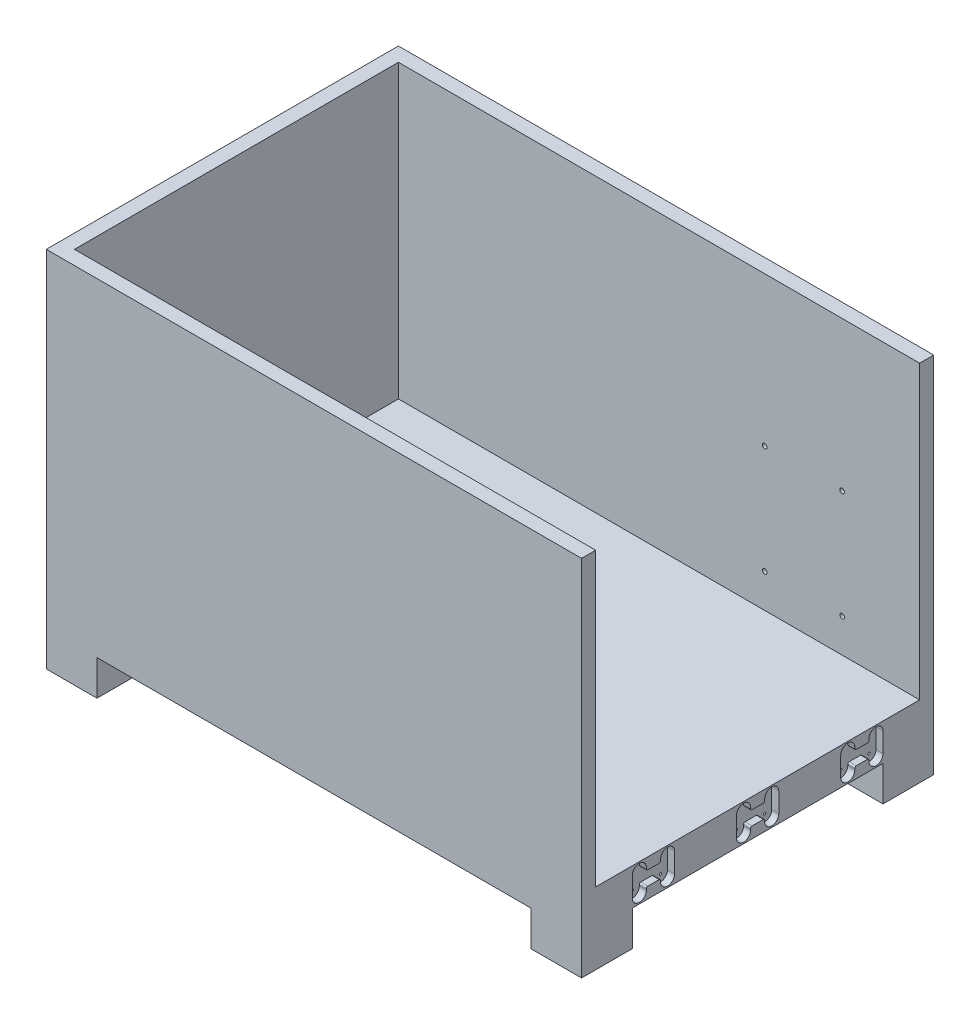
from build123d import *

# Parameters (mm, degrees)
SKETCH_1_W             = 380
SKETCH_1_H             = 250
EXTRUDE_1_DEPTH        = 233
SKETCH_4_W             = 36
SKETCH_4_H             = 36
EXTRUDE_2_DEPTH        = 25
HOLE_WIZARD_M6_1_D     = 5
HOLE_WIZARD_M6_1_DEPTH = 15
HOLE_WIZARD_M6_1_TIP   = 1.502151548
SKETCH_2_W             = 360
SKETCH_2_H             = 230
CUT_EXTRUDE_1_DEPTH    = 207
HOLE_WIZARD_M4_1_D     = 3.3
HOLE_WIZARD_M4_1_DEPTH = 10
SKETCH_7_W             = 10
SKETCH_7_H             = 230
CUT_EXTRUDE_3_DEPTH    = 207
HOLE_WIZARD_M2_1_D     = 1.6
HOLE_WIZARD_M2_1_DEPTH = 15
HOLE_WIZARD_M2_1_TIP   = 0.480688495
CUT_EXTRUDE_START      = -5
SKETCH_22_R            = 0.8
CUT_EXTRUDE_6_DEPTH    = 5


with BuildPart() as part:
    # 草图1 → 凸台-拉伸1 (new body)
    with BuildSketch(Plane(origin=(0, 0, 0), x_dir=(1, 0, 0), z_dir=(0, 1, 0))):
        with Locations((19.448818898, -32.543307087)):
            Rectangle(SKETCH_1_W, SKETCH_1_H)
    extrude(amount=EXTRUDE_1_DEPTH)

    # 草图4 → 凸台-拉伸2 (add)
    with BuildSketch(Plane.XZ):
        with Locations((-152.551181102, 139.543307087)):
            Rectangle(SKETCH_4_W, SKETCH_4_H)
        with Locations((191.448818898, 139.543307087)):
            Rectangle(SKETCH_4_W, SKETCH_4_H)
        with Locations((191.448818898, -74.456692913)):
            Rectangle(SKETCH_4_W, SKETCH_4_H)
        with Locations((-152.551181102, -74.456692913)):
            Rectangle(SKETCH_4_W, SKETCH_4_H)
    extrude(amount=EXTRUDE_2_DEPTH)

    # M6 螺纹孔1
    with Locations(Plane.XZ.offset(25)):
        with Locations((-152.551181102, -74.456692913), (-152.551181102, 139.543307087), (191.448818898, 139.543307087), (191.448818898, -74.456692913)):
            Hole(HOLE_WIZARD_M6_1_D / 2, depth=HOLE_WIZARD_M6_1_DEPTH)
            with Locations((0, 0, -(HOLE_WIZARD_M6_1_DEPTH + HOLE_WIZARD_M6_1_TIP / 2))):  # 118° drill point
                Cone(0, HOLE_WIZARD_M6_1_D / 2, HOLE_WIZARD_M6_1_TIP, mode=Mode.SUBTRACT)

    # 草图2 → 切除-拉伸1 (cut)
    with BuildSketch(Plane(origin=(0, 233, 0), x_dir=(1, 0, 0), z_dir=(0, 1, 0))):
        with Locations((19.448818898, -32.543307087)):
            Rectangle(SKETCH_2_W, SKETCH_2_H)
    extrude(amount=-CUT_EXTRUDE_1_DEPTH, mode=Mode.SUBTRACT)

    # M4 螺纹孔1
    with Locations(Plane(origin=(0, 0, -92.456692913), x_dir=(-1, 0, 0), z_dir=(0, 0, -1))):
        with Locations((-154.448818898, 127), (-99.448818898, 127), (-154.448818898, 50), (-99.448818898, 50)):
            Hole(HOLE_WIZARD_M4_1_D / 2, depth=HOLE_WIZARD_M4_1_DEPTH)

    # 草图7 → 切除-拉伸3 (cut)
    with BuildSketch(Plane(origin=(0, 233, 0), x_dir=(1, 0, 0), z_dir=(0, 1, 0))):
        with Locations((204.448818898, -32.543307087)):
            Rectangle(SKETCH_7_W, SKETCH_7_H)
    extrude(amount=-CUT_EXTRUDE_3_DEPTH, mode=Mode.SUBTRACT)

    # M2 螺纹孔1
    with Locations(Plane(origin=(209.448818898, 19.97945856, 116.543307087), x_dir=(0, 0, 1), z_dir=(1, 0, 0))):
        with Locations((0, 0), (0, 14), (-20, 14), (-20, 0), (-74, 0), (-74, 14), (-94, 0), (-94, 14), (-148, 0), (-168, 0), (-148, 14), (-168, 14)):
            Hole(HOLE_WIZARD_M2_1_D / 2, depth=HOLE_WIZARD_M2_1_DEPTH)
            with Locations((0, 0, -(HOLE_WIZARD_M2_1_DEPTH + HOLE_WIZARD_M2_1_TIP / 2))):  # 118° drill point
                Cone(0, HOLE_WIZARD_M2_1_D / 2, HOLE_WIZARD_M2_1_TIP, mode=Mode.SUBTRACT)

    # 草图22 → 切除-拉伸6 (cut)
    # profile 1 of 3: a face of its own
    with BuildSketch(Plane(origin=(209.448818898, 0, 0), x_dir=(0, 0, -1), z_dir=(1, 0, 0)).offset(CUT_EXTRUDE_START)):
        with BuildLine():
            Line((-101.543307087, 6.97945856), (-101.543307087, 5.97945856))
            ThreePointArc((-101.543307087, 5.97945856), (-96.543307087, 0.97945856), (-91.543307087, 5.97945856))
            Line((-91.543307087, 5.97945856), (-91.543307087, 19.97945856))
            ThreePointArc((-91.543307087, 19.97945856), (-96.543307087, 24.97945856), (-101.543307087, 19.97945856))
            Line((-101.543307087, 19.97945856), (-101.543307087, 18.97945856))
            ThreePointArc((-101.543307087, 18.97945856), (-101.836200305, 18.272351779), (-102.543307087, 17.97945856))
            Line((-102.543307087, 17.97945856), (-110.543307087, 17.97945856))
            ThreePointArc((-110.543307087, 17.97945856), (-111.250413868, 18.272351779), (-111.543307087, 18.97945856))
            Line((-111.543307087, 18.97945856), (-111.543307087, 19.97945856))
            ThreePointArc((-111.543307087, 19.97945856), (-116.543307087, 24.97945856), (-121.543307087, 19.97945856))
            Line((-121.543307087, 19.97945856), (-121.543307087, 5.97945856))
            ThreePointArc((-121.543307087, 5.97945856), (-116.543307087, 0.97945856), (-111.543307087, 5.97945856))
            Line((-111.543307087, 5.97945856), (-111.543307087, 6.97945856))
            ThreePointArc((-111.543307087, 6.97945856), (-111.250413868, 7.686565341), (-110.543307087, 7.97945856))
            Line((-110.543307087, 7.97945856), (-102.543307087, 7.97945856))
            ThreePointArc((-102.543307087, 7.97945856), (-101.836200305, 7.686565341), (-101.543307087, 6.97945856))
        make_face()
        with Locations((-96.543307087, 5.97945856)):
            Circle(SKETCH_22_R, mode=Mode.SUBTRACT)
        with Locations((-96.543307087, 19.97945856)):
            Circle(SKETCH_22_R, mode=Mode.SUBTRACT)
        with Locations((-116.543307087, 5.97945856)):
            Circle(SKETCH_22_R, mode=Mode.SUBTRACT)
        with Locations((-116.543307087, 19.97945856)):
            Circle(SKETCH_22_R, mode=Mode.SUBTRACT)
    # profile 2 of 3: a face of its own
    with BuildSketch(Plane(origin=(209.448818898, 0, 0), x_dir=(0, 0, -1), z_dir=(1, 0, 0)).offset(CUT_EXTRUDE_START)):
        with BuildLine():
            ThreePointArc((46.456692913, 5.97945856), (51.456692913, 0.97945856), (56.456692913, 5.97945856))
            Line((56.456692913, 5.97945856), (56.456692913, 19.97945856))
            ThreePointArc((56.456692913, 19.97945856), (51.456692913, 24.97945856), (46.456692913, 19.97945856))
            Line((46.456692913, 19.97945856), (46.456692913, 18.97945856))
            ThreePointArc((46.456692913, 18.97945856), (46.163799695, 18.272351779), (45.456692913, 17.97945856))
            Line((45.456692913, 17.97945856), (37.456692913, 17.97945856))
            ThreePointArc((37.456692913, 17.97945856), (36.749586132, 18.272351779), (36.456692913, 18.97945856))
            Line((36.456692913, 18.97945856), (36.456692913, 19.97945856))
            ThreePointArc((36.456692913, 19.97945856), (31.456692913, 24.97945856), (26.456692913, 19.97945856))
            Line((26.456692913, 19.97945856), (26.456692913, 5.97945856))
            ThreePointArc((26.456692913, 5.97945856), (31.456692913, 0.97945856), (36.456692913, 5.97945856))
            Line((36.456692913, 5.97945856), (36.456692913, 6.97945856))
            ThreePointArc((36.456692913, 6.97945856), (36.749586132, 7.686565341), (37.456692913, 7.97945856))
            Line((37.456692913, 7.97945856), (45.456692913, 7.97945856))
            ThreePointArc((45.456692913, 7.97945856), (46.163799695, 7.686565341), (46.456692913, 6.97945856))
            Line((46.456692913, 6.97945856), (46.456692913, 5.97945856))
        make_face()
        with Locations((31.456692913, 19.97945856)):
            Circle(SKETCH_22_R, mode=Mode.SUBTRACT)
        with Locations((31.456692913, 5.97945856)):
            Circle(SKETCH_22_R, mode=Mode.SUBTRACT)
        with Locations((51.456692913, 19.97945856)):
            Circle(SKETCH_22_R, mode=Mode.SUBTRACT)
        with Locations((51.456692913, 5.97945856)):
            Circle(SKETCH_22_R, mode=Mode.SUBTRACT)
    # profile 3 of 3: a face of its own
    with BuildSketch(Plane(origin=(209.448818898, 0, 0), x_dir=(0, 0, -1), z_dir=(1, 0, 0)).offset(CUT_EXTRUDE_START)):
        with BuildLine():
            Line((-27.543307087, 6.97945856), (-27.543307087, 5.97945856))
            ThreePointArc((-27.543307087, 5.97945856), (-22.543307087, 0.97945856), (-17.543307087, 5.97945856))
            Line((-17.543307087, 5.97945856), (-17.543307087, 19.97945856))
            ThreePointArc((-17.543307087, 19.97945856), (-22.543307087, 24.97945856), (-27.543307087, 19.97945856))
            Line((-27.543307087, 19.97945856), (-27.543307087, 18.97945856))
            ThreePointArc((-27.543307087, 18.97945856), (-27.836200305, 18.272351779), (-28.543307087, 17.97945856))
            Line((-28.543307087, 17.97945856), (-36.543307087, 17.97945856))
            ThreePointArc((-36.543307087, 17.97945856), (-37.250413868, 18.272351779), (-37.543307087, 18.97945856))
            Line((-37.543307087, 18.97945856), (-37.543307087, 19.97945856))
            ThreePointArc((-37.543307087, 19.97945856), (-42.543307087, 24.97945856), (-47.543307087, 19.97945856))
            Line((-47.543307087, 19.97945856), (-47.543307087, 5.97945856))
            ThreePointArc((-47.543307087, 5.97945856), (-42.543307087, 0.97945856), (-37.543307087, 5.97945856))
            Line((-37.543307087, 5.97945856), (-37.543307087, 6.97945856))
            ThreePointArc((-37.543307087, 6.97945856), (-37.250413868, 7.686565341), (-36.543307087, 7.97945856))
            Line((-36.543307087, 7.97945856), (-28.543307087, 7.97945856))
            ThreePointArc((-28.543307087, 7.97945856), (-27.836200305, 7.686565341), (-27.543307087, 6.97945856))
        make_face()
        with Locations((-42.543307087, 19.97945856)):
            Circle(SKETCH_22_R, mode=Mode.SUBTRACT)
        with Locations((-42.543307087, 5.97945856)):
            Circle(SKETCH_22_R, mode=Mode.SUBTRACT)
        with Locations((-22.543307087, 19.97945856)):
            Circle(SKETCH_22_R, mode=Mode.SUBTRACT)
        with Locations((-22.543307087, 5.97945856)):
            Circle(SKETCH_22_R, mode=Mode.SUBTRACT)
    extrude(amount=CUT_EXTRUDE_6_DEPTH, mode=Mode.SUBTRACT)


solid = part.part
